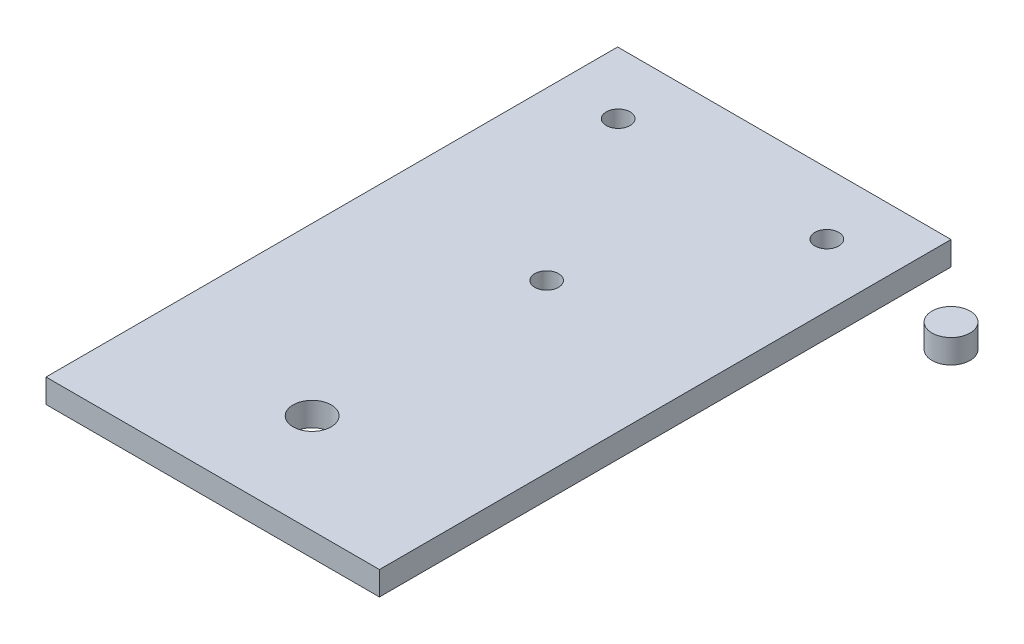
from build123d import *

# Parameters (mm, degrees)
SKETCH1_R             = 4
BOSS_EXTRUDE1_DEPTH   = 5
SKETCH1_W             = 70
SKETCH1_H             = 120
SKETCH1_R_2           = 2.5
BOSS_EXTRUDE1_2_DEPTH = 5


with BuildPart() as part:
    # Sketch1 → Boss-Extrude1 (new body)
    with BuildSketch(Plane(origin=(0, 0, 0), x_dir=(1, 0, 0), z_dir=(0, 1, 0))):
        with Locations(Location((85, -12.05400982, 0), (0, 0, 270))):
            Circle(SKETCH1_R)
    extrude(amount=BOSS_EXTRUDE1_DEPTH)


with BuildPart() as body_2:
    # Sketch1 → Boss-Extrude1 2 (new body)
    with BuildSketch(Plane(origin=(0, 0, 0), x_dir=(1, 0, 0), z_dir=(0, 1, 0))):
        with Locations((35, -57.05400982)):
            Rectangle(SKETCH1_W, SKETCH1_H)
        with Locations(Location((13.097845213, -10.034574012, 0), (0, 0, 270))):
            Circle(SKETCH1_R_2, mode=Mode.SUBTRACT)
        with Locations(Location((56.902154787, -10.034574012, 0), (0, 0, 90))):
            Circle(SKETCH1_R_2, mode=Mode.SUBTRACT)
        with Locations(Location((35, -46.957253621, 0), (0, 0, 270))):
            Circle(SKETCH1_R_2, mode=Mode.SUBTRACT)
        with Locations(Location((35, -96.182185262, 0), (0, 0, 270))):
            Circle(SKETCH1_R, mode=Mode.SUBTRACT)
    extrude(amount=BOSS_EXTRUDE1_2_DEPTH)


solid = Compound([part.part, body_2.part])
